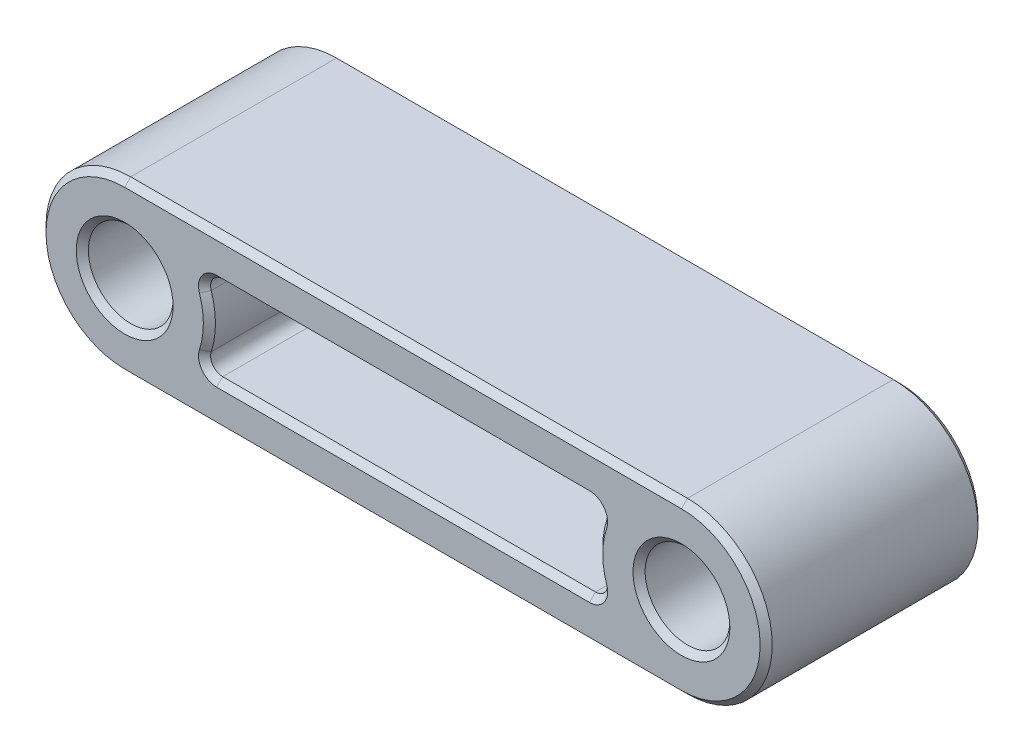
from build123d import *

# Parameters (mm, degrees)
SKETCH1_R           = 1.75
BOSS_EXTRUDE1_DEPTH = 9
FILLET1_R           = 0.5
CHAMFER2_SIZE       = 0.25


with BuildPart() as part:
    # Sketch1 → Boss-Extrude1 (new body)
    with BuildSketch(Plane.XY):
        with BuildLine():
            Line((-11.5, 3.5), (11.5, 3.5))
            ThreePointArc((11.5, 3.5), (15, 0), (11.5, -3.5))
            Line((11.5, -3.5), (-11.5, -3.5))
            ThreePointArc((-11.5, -3.5), (-15, 0), (-11.5, 3.5))
        make_face()
        with Locations((-11.5, 0)):
            Circle(SKETCH1_R, mode=Mode.SUBTRACT)
        with Locations((11.5, 0)):
            Circle(SKETCH1_R, mode=Mode.SUBTRACT)
        with BuildLine():
            Line((-8.468911087, 1.75), (8.468911087, 1.75))
            ThreePointArc((8.468911087, 1.75), (8, 0), (8.468911087, -1.75))
            Line((8.468911087, -1.75), (-8.468911087, -1.75))
            ThreePointArc((-8.468911087, -1.75), (-8, 0), (-8.468911087, 1.75))
        make_face(mode=Mode.SUBTRACT)
    extrude(amount=BOSS_EXTRUDE1_DEPTH)

    # Fillet1
    fillet1_edges = [part.edges().sort_by_distance(p)[0] for p in [
        (-8.468911087, 1.75, 4.5),
        (-8.468911087, -1.75, 4.5),
        (8.468911087, -1.75, 4.5),
        (8.468911087, 1.75, 4.5),
    ]]
    fillet(fillet1_edges, radius=FILLET1_R)

    # Chamfer2
    chamfer2_edges = [part.edges().sort_by_distance(p)[0] for p in [
        (9.75, 0, 0),
        (9.75, 0, 9),
        (15, 0, 9),
        (-13.25, 0, 0),
        (-13.25, 0, 9),
        (0, 3.5, 9),
        (0, -1.75, 0),
        (0, -1.75, 9),
        (8, 0, 0),
        (8, 0, 9),
        (0, 1.75, 0),
        (0, 1.75, 9),
        (-8, 0, 0),
        (-8, 0, 9),
        (8.105375255, -1.543150985, 0),
        (8.105375255, -1.543150985, 9),
        (8.105375255, 1.543150985, 0),
        (8.105375255, 1.543150985, 9),
        (-8.105375255, 1.543150985, 0),
        (-8.105375255, 1.543150985, 9),
        (-8.105375255, -1.543150985, 0),
        (-8.105375255, -1.543150985, 9),
        (-15, 0, 9),
        (0, 3.5, 0),
        (15, 0, 0),
        (0, -3.5, 0),
        (-15, 0, 0),
        (0, -3.5, 9),
    ]]
    chamfer(chamfer2_edges, length=CHAMFER2_SIZE)


solid = part.part
